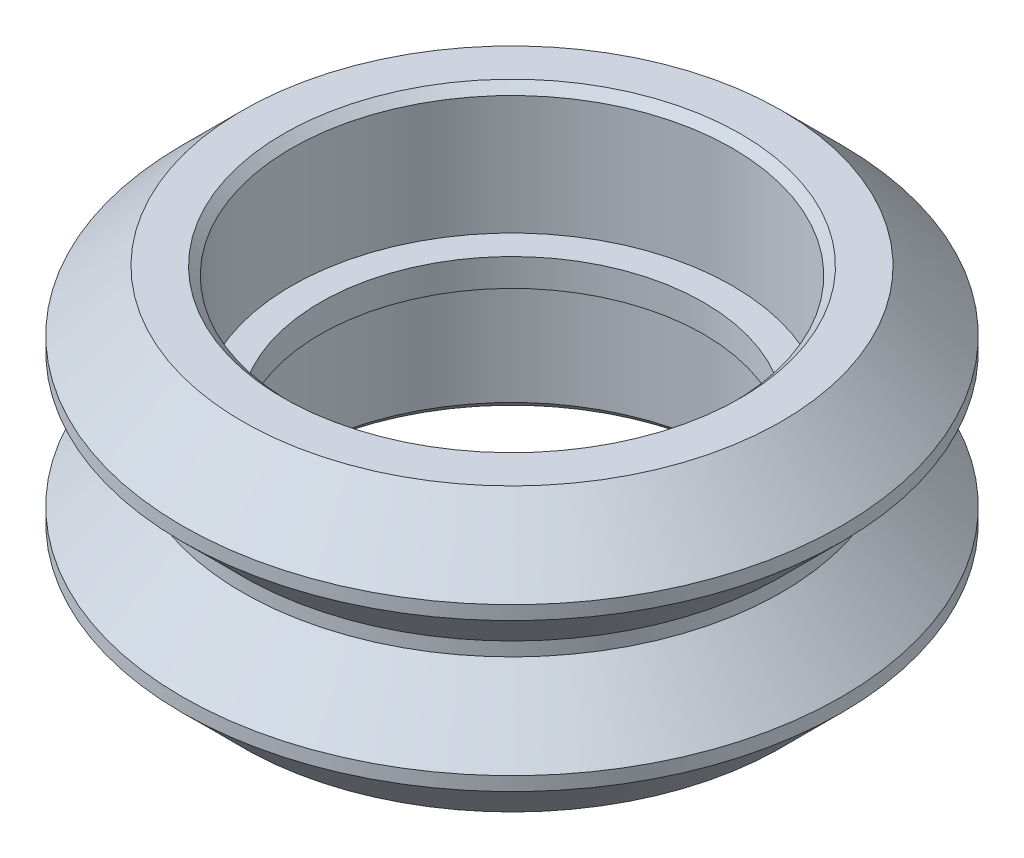
from build123d import *


with BuildPart() as part:
    # Esquisse1 → Révolution1 (revolve)
    with BuildSketch(Plane.XY, mode=Mode.PRIVATE) as r_volution1_sk:
        Polygon((7.987, 9.93), (7.987, 5.615), (6.945, 5.615), (6.945, 4.615), (7.987, 4.615), (7.987, 0.3), (8.287, 0), (9.7625, 0), (11.945, 2.1825), (11.945, 2.6825), (9.7625, 4.865), (9.7625, 5.365), (11.945, 7.5475), (11.945, 8.0475), (9.7625, 10.23), (8.287, 10.23), align=None)
    revolve(r_volution1_sk.sketch.rotate(Axis((0, 0, 0), (0, 1, 0)), 90), axis=Axis((0, 0, 0), (0, 1, 0)))


solid = part.part
